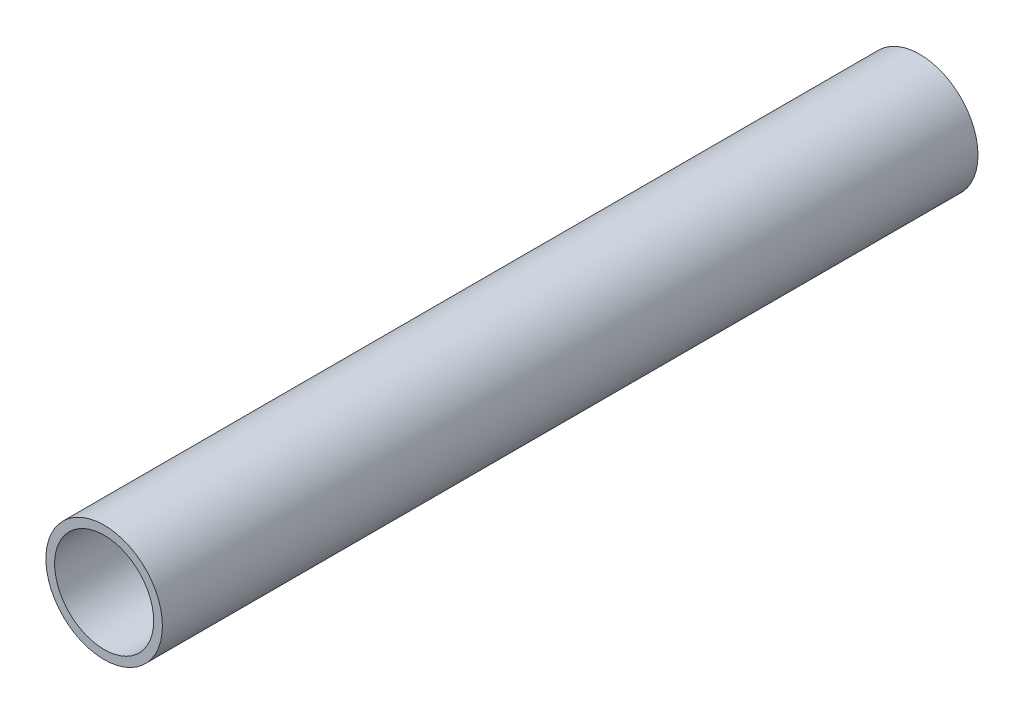
from build123d import *

# Parameters (mm, degrees)
PIPESKETCH_R    = 10
PIPESKETCH_R_2  = 8.5
EXTRUSION_DEPTH = 140


with BuildPart() as part:
    # PipeSketch → Extrusion (new body)
    with BuildSketch(Plane.XY):
        Circle(PIPESKETCH_R)
        Circle(PIPESKETCH_R_2, mode=Mode.SUBTRACT)
    extrude(amount=EXTRUSION_DEPTH)


solid = part.part
